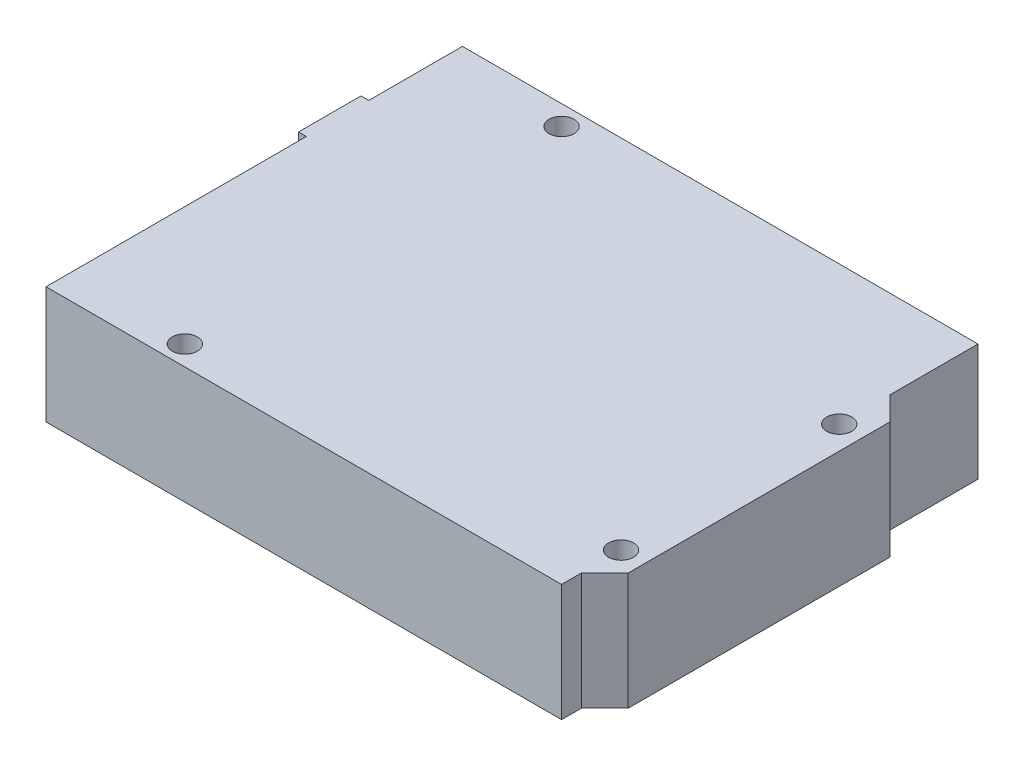
from build123d import *

# Parameters (mm, degrees)
SZKIC1_R                    = 1.6
DODANIE_WYCI_GNI_CIE1_DEPTH = 15
SZKIC2_W                    = 2
SZKIC2_H                    = 9
WYTNIJ_WYCI_GNI_CIE1_DEPTH  = 88.018168218


with BuildPart() as part:
    # Szkic1 → Dodanie-wyciągnięcie1 (new body)
    with BuildSketch(Plane(origin=(0, 0, 0), x_dir=(1, 0, 0), z_dir=(0, 1, 0))):
        Polygon((0, -2.54), (66.04, -2.54), (66.04, 0), (69.04, 3), (69.04, 36.5), (66.04, 39.5), (66.04, 50.8), (0, 50.8), (0, 38.8), (-1, 38.8), (-1, 30.8), (0, 30.8), (0, 9), (-2, 9), (-2, 0), (0, 0), align=None)
        with Locations(Location((15.24, 0, 0), (0, 0, 270))):
            Circle(SZKIC1_R, mode=Mode.SUBTRACT)
        with Locations(Location((66.04, 33.02, 0), (0, 0, 270))):
            Circle(SZKIC1_R, mode=Mode.SUBTRACT)
        with Locations(Location((66.04, 5.08, 0), (0, 0, 270))):
            Circle(SZKIC1_R, mode=Mode.SUBTRACT)
        with Locations(Location((15.24, 48.26, 0), (0, 0, 270))):
            Circle(SZKIC1_R, mode=Mode.SUBTRACT)
    extrude(amount=DODANIE_WYCI_GNI_CIE1_DEPTH)

    # Szkic2 → Wytnij-wyciągnięcie1 (cut, through all)
    with BuildSketch(Plane(origin=(0, 15, 0), x_dir=(1, 0, 0), z_dir=(0, 1, 0))):
        with Locations((-1, 4.5)):
            Rectangle(SZKIC2_W, SZKIC2_H)
    extrude(amount=-WYTNIJ_WYCI_GNI_CIE1_DEPTH, mode=Mode.SUBTRACT)


solid = part.part
